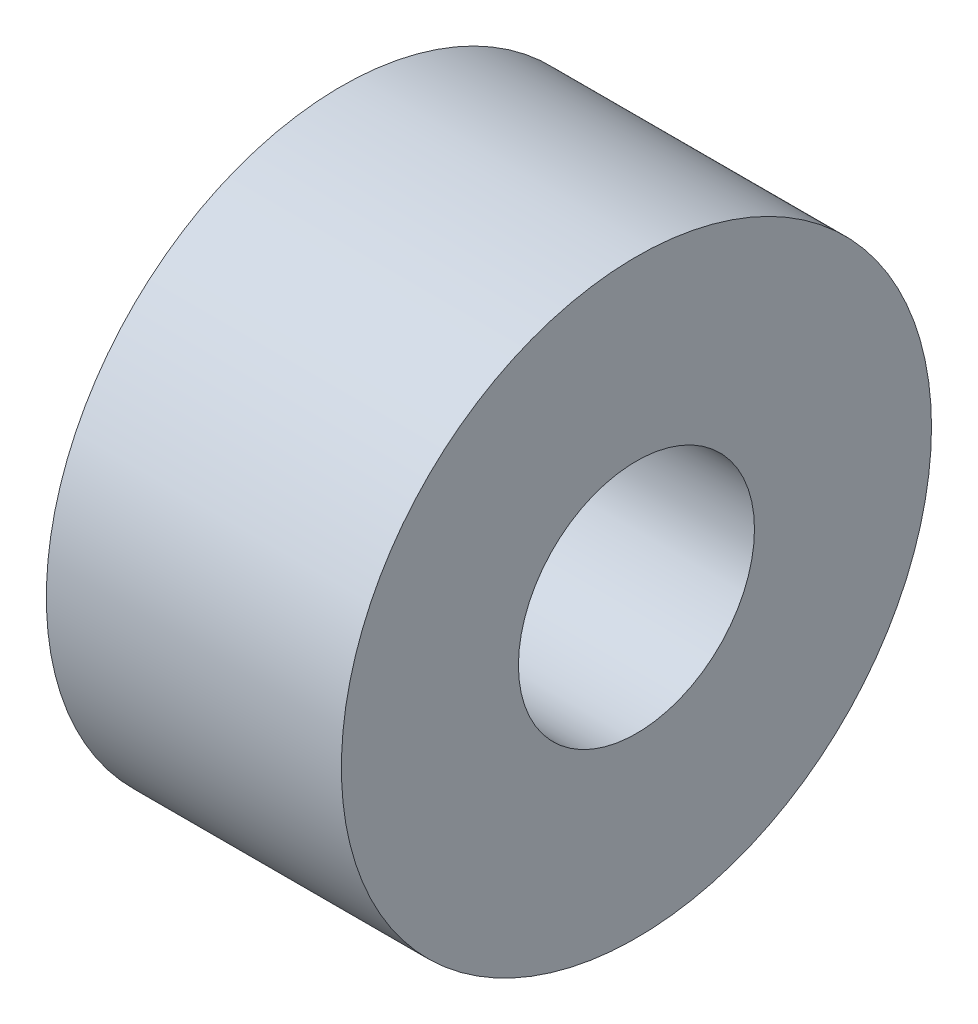
from build123d import *

# Parameters (mm, degrees)
SKETCH_1_R      = 10
SKETCH_1_R_2    = 4
EXTRUDE_1_DEPTH = 10


with BuildPart() as part:
    # Эскиз1 → Вытянуть1 (new body)
    with BuildSketch(Plane(origin=(0, 0, 0), x_dir=(0, 0, -1), z_dir=(1, 0, 0))):
        Circle(SKETCH_1_R)
        Circle(SKETCH_1_R_2, mode=Mode.SUBTRACT)
    extrude(amount=EXTRUDE_1_DEPTH)


solid = part.part
